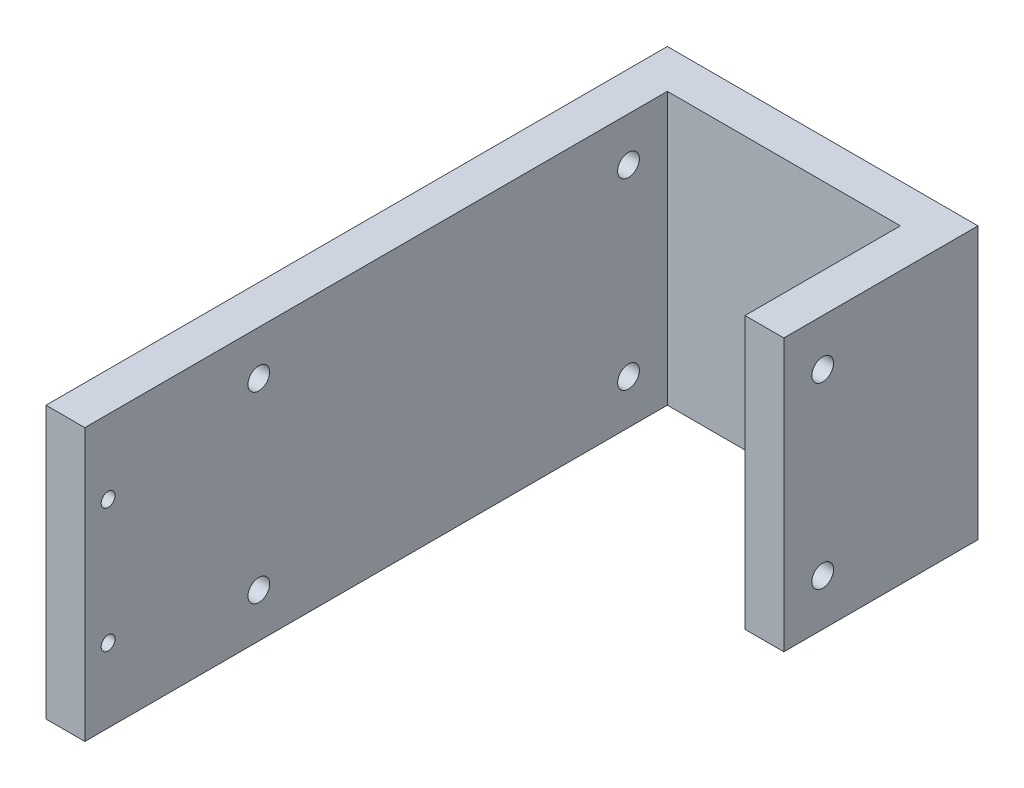
from build123d import *

# Parameters (mm, degrees)
BOSS_EXTRUDE1_DEPTH = 35
SKETCH3_R           = 1.4
CUT_EXTRUDE1_DEPTH  = 5
SKETCH4_R           = 1.4
CUT_EXTRUDE2_DEPTH  = 5
CUT_EXTRUDE3_DEPTH  = 2.3
SKETCH6_R           = 0.9
CUT_EXTRUDE4_DEPTH  = 5


with BuildPart() as part:
    # Sketch1 → Boss-Extrude1 (new body)
    with BuildSketch(Plane(origin=(0, 0, 0), x_dir=(1, 0, 0), z_dir=(0, 1, 0))):
        Polygon((0, 0), (5, 0), (40, 0), (40, -5), (40, -25), (35, -25), (35, -5), (5, -5), (5, -80), (0, -80), align=None)
    extrude(amount=BOSS_EXTRUDE1_DEPTH)

    # Sketch3 → Cut-Extrude1 (cut)
    with BuildSketch(Plane(origin=(40, 0, 0), x_dir=(0, 0, -1), z_dir=(1, 0, 0))):
        with Locations((-20, 29)):
            Circle(SKETCH3_R)
        with Locations((-20, 6)):
            Circle(SKETCH3_R)
    extrude(amount=-CUT_EXTRUDE1_DEPTH, mode=Mode.SUBTRACT)

    # Sketch4 → Cut-Extrude2 (cut)
    with BuildSketch(Plane.ZY):
        with Locations((10, 29.3)):
            Circle(SKETCH4_R)
        with Locations((57.6, 29.3)):
            Circle(SKETCH4_R)
        with Locations((57.6, 5.7)):
            Circle(SKETCH4_R)
        with Locations((10, 5.7)):
            Circle(SKETCH4_R)
    extrude(amount=-CUT_EXTRUDE2_DEPTH, mode=Mode.SUBTRACT)

    # Sketch5 → Cut-Extrude3 (cut)
    with BuildSketch(Plane.ZY):
        Polygon((1.305296416, 33.993673453), (0.792101755, 32.895205775), (1.486805338, 31.901532322), (2.694703584, 32.006326547), (3.207898245, 33.104794225), (2.513194662, 34.098467678), align=None)
        Polygon((2.614505204, 3.045171447), (1.402107578, 3.054762841), (0.787602373, 2.009591394), (1.385494796, 0.954828553), (2.597892422, 0.945237159), (3.212397627, 1.990408606), align=None)
        Polygon((78.957273376, 2.744061612), (77.83426043, 3.201053868), (76.876987054, 2.456992256), (77.042726624, 1.255938388), (78.16573957, 0.798946132), (79.123012946, 1.543007744), align=None)
        Polygon((78.740718882, 33.959862249), (77.539094349, 34.121412494), (76.798375467, 33.161550244), (77.259281118, 32.040137751), (78.460905651, 31.878587506), (79.201624533, 32.838449756), align=None)
    extrude(amount=-CUT_EXTRUDE3_DEPTH, mode=Mode.SUBTRACT)

    # Sketch6 → Cut-Extrude4 (cut)
    with BuildSketch(Plane.ZY):
        with Locations((77, 25.5)):
            Circle(SKETCH6_R)
        with Locations((77, 9.5)):
            Circle(SKETCH6_R)
    extrude(amount=-CUT_EXTRUDE4_DEPTH, mode=Mode.SUBTRACT)


solid = part.part
